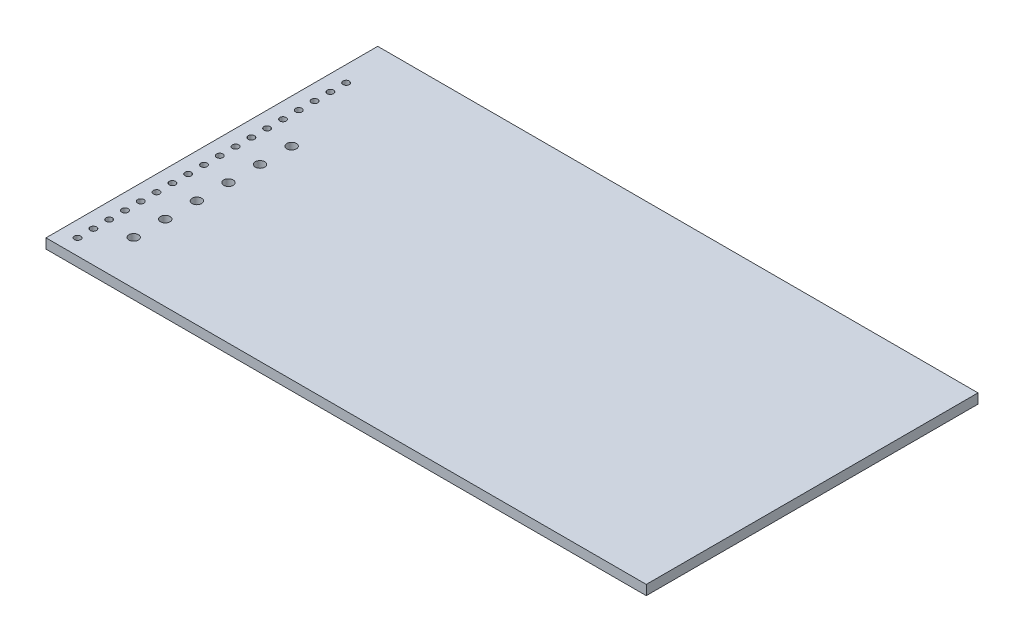
from build123d import *

# Parameters (mm, degrees)
SKETCH1_W           = 96.52
SKETCH1_H           = 53.34
BOSS_EXTRUDE1_DEPTH = 1.5748
SKETCH2_R           = 0.508
SKETCH2_R_2         = 0.762
CUT_EXTRUDE1_DEPTH  = 111.289373899


with BuildPart() as part:
    # Sketch1 → Boss-Extrude1 (new body)
    with BuildSketch(Plane(origin=(0, 0, 0), x_dir=(1, 0, 0), z_dir=(0, 1, 0))):
        with Locations((48.26, 26.67)):
            Rectangle(SKETCH1_W, SKETCH1_H)
    extrude(amount=BOSS_EXTRUDE1_DEPTH)

    # Sketch2 → Cut-Extrude1 (cut, through all)
    with BuildSketch(Plane(origin=(0, 1.5748, 0), x_dir=(1, 0, 0), z_dir=(0, 1, 0))):
        with Locations(Location((2.54, 2.54, 0), (0, 0, 270))):
            Circle(SKETCH2_R)
        with Locations(Location((2.54, 5.08, 0), (0, 0, 270))):
            Circle(SKETCH2_R)
        with Locations(Location((2.54, 7.62, 0), (0, 0, 270))):
            Circle(SKETCH2_R)
        with Locations(Location((2.54, 10.16, 0), (0, 0, 270))):
            Circle(SKETCH2_R)
        with Locations(Location((2.54, 12.7, 0), (0, 0, 270))):
            Circle(SKETCH2_R)
        with Locations(Location((2.54, 15.24, 0), (0, 0, 270))):
            Circle(SKETCH2_R)
        with Locations(Location((2.54, 17.78, 0), (0, 0, 270))):
            Circle(SKETCH2_R)
        with Locations(Location((2.54, 20.32, 0), (0, 0, 270))):
            Circle(SKETCH2_R)
        with Locations(Location((2.54, 22.86, 0), (0, 0, 270))):
            Circle(SKETCH2_R)
        with Locations(Location((2.54, 25.4, 0), (0, 0, 270))):
            Circle(SKETCH2_R)
        with Locations(Location((2.54, 27.94, 0), (0, 0, 270))):
            Circle(SKETCH2_R)
        with Locations(Location((2.54, 30.48, 0), (0, 0, 270))):
            Circle(SKETCH2_R)
        with Locations(Location((2.54, 33.02, 0), (0, 0, 270))):
            Circle(SKETCH2_R)
        with Locations(Location((2.54, 35.56, 0), (0, 0, 270))):
            Circle(SKETCH2_R)
        with Locations(Location((2.54, 38.1, 0), (0, 0, 270))):
            Circle(SKETCH2_R)
        with Locations(Location((2.54, 40.64, 0), (0, 0, 270))):
            Circle(SKETCH2_R)
        with Locations(Location((2.54, 43.18, 0), (0, 0, 270))):
            Circle(SKETCH2_R)
        with Locations(Location((2.54, 45.72, 0), (0, 0, 270))):
            Circle(SKETCH2_R)
        with Locations(Location((6.985, 7.112, 0), (0, 0, 270))):
            Circle(SKETCH2_R_2)
        with Locations(Location((6.985, 12.192, 0), (0, 0, 270))):
            Circle(SKETCH2_R_2)
        with Locations(Location((6.985, 17.272, 0), (0, 0, 270))):
            Circle(SKETCH2_R_2)
        with Locations(Location((6.985, 22.352, 0), (0, 0, 270))):
            Circle(SKETCH2_R_2)
        with Locations(Location((6.985, 27.432, 0), (0, 0, 270))):
            Circle(SKETCH2_R_2)
        with Locations(Location((6.985, 32.512, 0), (0, 0, 270))):
            Circle(SKETCH2_R_2)
    extrude(amount=-CUT_EXTRUDE1_DEPTH, mode=Mode.SUBTRACT)


solid = part.part
